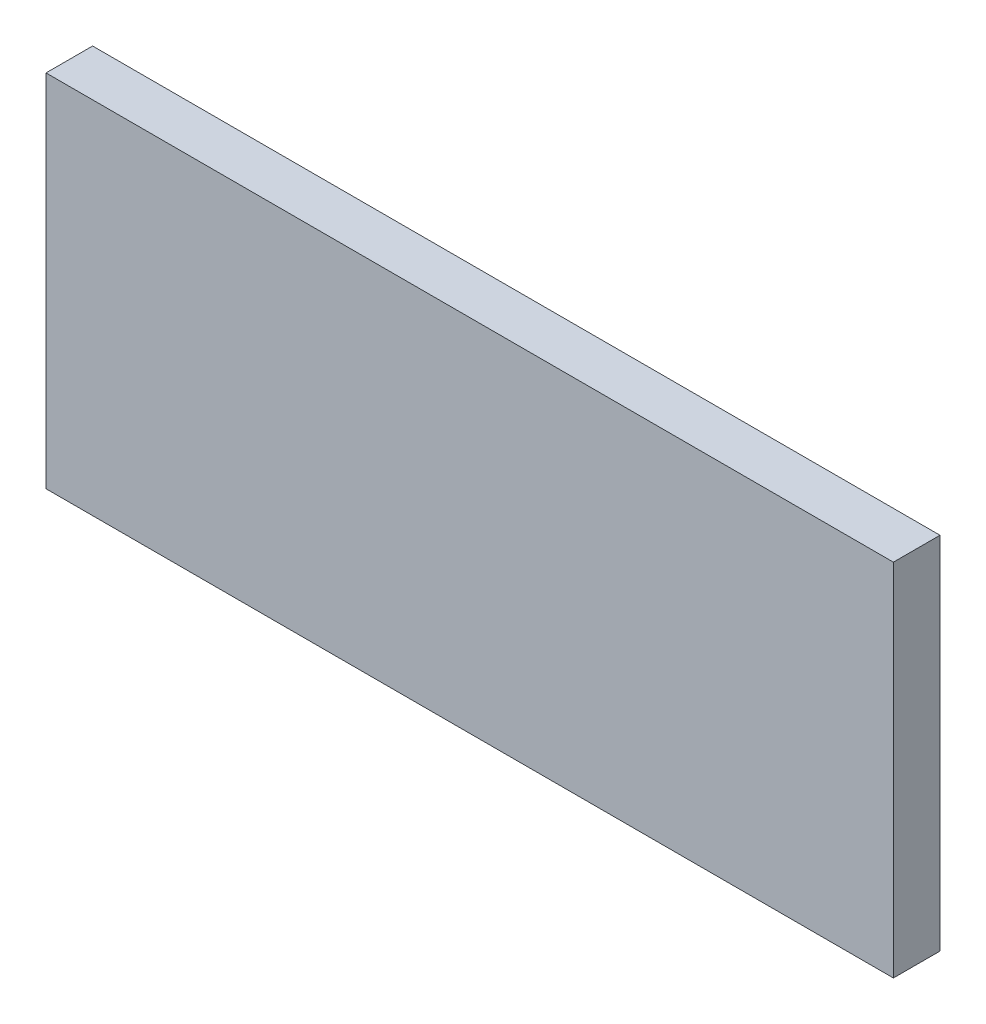
from build123d import *

# Parameters (mm, degrees)
SKETCH1_W           = 101.6
SKETCH1_H           = 43.18
BOSS_EXTRUDE1_DEPTH = 5.588


with BuildPart() as part:
    # Sketch1 → Boss-Extrude1 (new body)
    with BuildSketch(Plane.XY):
        Rectangle(SKETCH1_W, SKETCH1_H)
    extrude(amount=BOSS_EXTRUDE1_DEPTH)


solid = part.part
